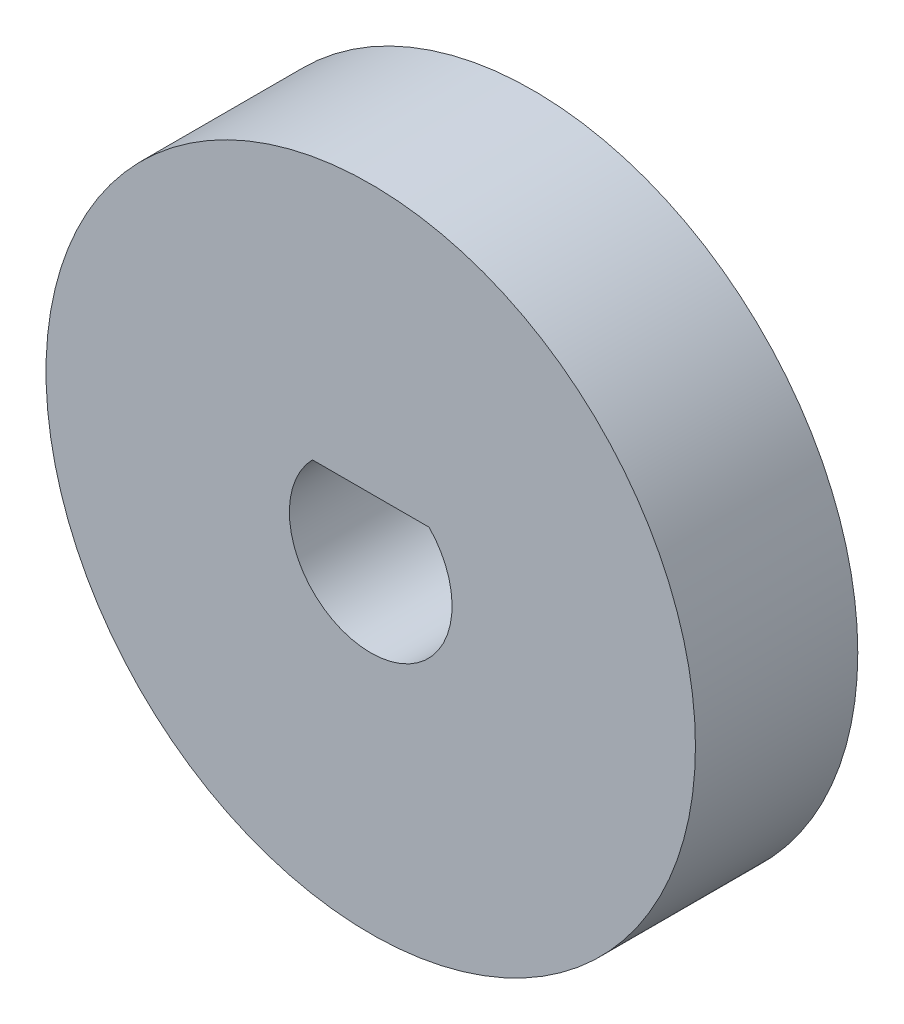
from build123d import *

# Parameters (mm, degrees)
SKETCH1_R           = 12.7
BOSS_EXTRUDE1_DEPTH = 6.35


with BuildPart() as part:
    # Sketch1 → Boss-Extrude1 (new body)
    with BuildSketch(Plane.XY):
        Circle(SKETCH1_R)
        with BuildLine():
            Line((-2.282469496, 2.21615), (2.282469496, 2.21615))
            ThreePointArc((2.282469496, 2.21615), (0, -3.18135), (-2.282469496, 2.21615))
        make_face(mode=Mode.SUBTRACT)
    extrude(amount=BOSS_EXTRUDE1_DEPTH)


solid = part.part
